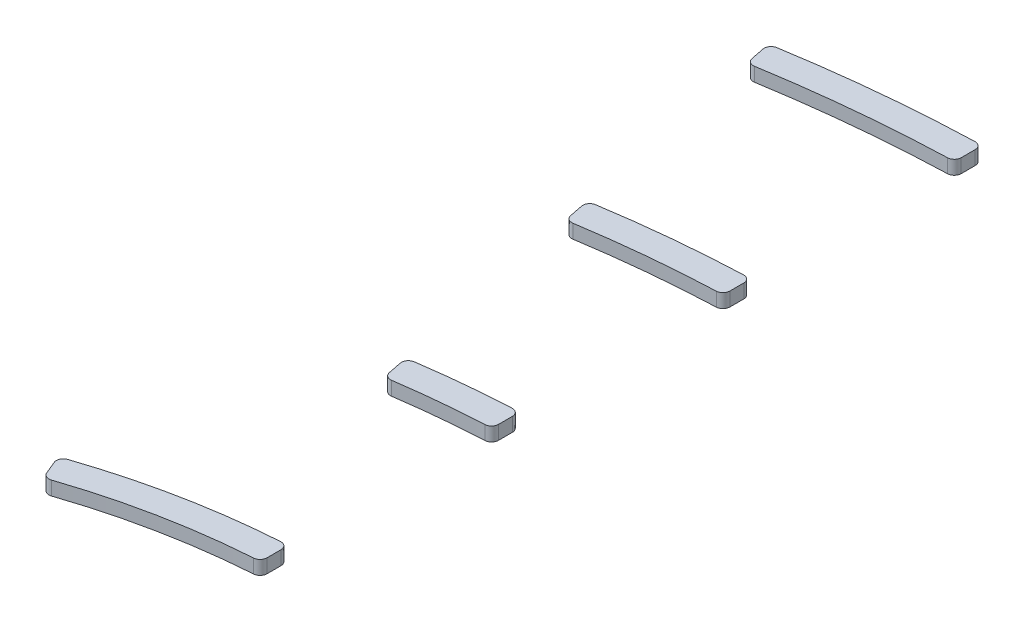
from build123d import *

# Parameters (mm, degrees)
AUFSATZ_LINEAR_AUSTRAGEN1_DEPTH   = 3
AUFSATZ_LINEAR_AUSTRAGEN1_2_DEPTH = 3
AUFSATZ_LINEAR_AUSTRAGEN1_3_DEPTH = 3
AUFSATZ_LINEAR_AUSTRAGEN1_4_DEPTH = 3


with BuildPart() as part:
    # Skizze1 → Aufsatz-Linear austragen1 (new body)
    with BuildSketch(Plane(origin=(0, 0, 0), x_dir=(1, 0, 0), z_dir=(0, 1, 0))):
        with BuildLine():
            Line((-8.459259515, 300.16557037), (-8.461766311, 297.163818853))
            ThreePointArc((-8.461766311, 297.163818853), (-8.883919397, 296.121880665), (-9.911510017, 295.665913636))
            ThreePointArc((-9.911510017, 295.665913636), (-28.996200706, 294.407525145), (-47.95969069, 291.918547863))
            ThreePointArc((-47.95969069, 291.918547863), (-49.056377816, 292.165205658), (-49.673747794, 293.104576208))
            Line((-49.673747794, 293.104576208), (-50.262352563, 296.048073311))
            ThreePointArc((-50.262352563, 296.048073311), (-50.025118954, 297.195499354), (-49.035160138, 297.822275112))
            ThreePointArc((-49.035160138, 297.822275112), (-29.5845698, 300.378607282), (-10.00900024, 301.665998079))
            ThreePointArc((-10.00900024, 301.665998079), (-8.915883192, 301.244490397), (-8.459259515, 300.16557037))
        make_face()
    extrude(amount=AUFSATZ_LINEAR_AUSTRAGEN1_DEPTH)


with BuildPart() as body_2:
    # Skizze1 → Aufsatz-Linear austragen1 2 (new body)
    with BuildSketch(Plane(origin=(0, 0, 0), x_dir=(1, 0, 0), z_dir=(0, 1, 0))):
        with BuildLine():
            Line((-48.346968769, 139.159115699), (-49.50004695, 141.936330487))
            ThreePointArc((-49.50004695, 141.936330487), (-49.480752189, 143.13112709), (-48.594528312, 143.932699575))
            ThreePointArc((-48.594528312, 143.932699575), (-29.63707112, 148.995618071), (-10.185169404, 151.572796085))
            ThreePointArc((-10.185169404, 151.572796085), (-9.059656793, 151.171382867), (-8.584601893, 150.074918526))
            Line((-8.584601893, 150.074918526), (-8.587113136, 147.06784271))
            ThreePointArc((-8.587113136, 147.06784271), (-8.991191611, 146.044909281), (-9.98447239, 145.572611168))
            ThreePointArc((-9.98447239, 145.572611168), (-28.466529188, 143.110906388), (-46.483776816, 138.312448117))
            ThreePointArc((-46.483776816, 138.312448117), (-47.582189261, 138.368682579), (-48.346968769, 139.159115699))
        make_face()
    extrude(amount=AUFSATZ_LINEAR_AUSTRAGEN1_2_DEPTH)


with BuildPart() as body_3:
    # Skizze1 → Aufsatz-Linear austragen1 3 (new body)
    with BuildSketch(Plane(origin=(0, 0, 0), x_dir=(1, 0, 0), z_dir=(0, 1, 0))):
        with BuildLine():
            Line((-30.055632937, 194.998228293), (-30.644675496, 197.943914697))
            ThreePointArc((-30.644675496, 197.943914697), (-30.400116287, 199.101835671), (-29.392191291, 199.722059334))
            ThreePointArc((-29.392191291, 199.722059334), (-19.777857967, 200.902061283), (-10.117988803, 201.619513431))
            ThreePointArc((-10.117988803, 201.619513431), (-9.008616199, 201.207882549), (-8.542808565, 200.120145998))
            Line((-8.542808565, 200.120145998), (-8.545317206, 197.116185466))
            ThreePointArc((-8.545317206, 197.116185466), (-8.958431865, 196.083667659), (-9.968974137, 195.619382121))
            ThreePointArc((-9.968974137, 195.619382121), (-19.18962485, 194.930965741), (-28.367514003, 193.808171283))
            ThreePointArc((-28.367514003, 193.808171283), (-29.449023063, 194.066372937), (-30.055632937, 194.998228293))
        make_face()
    extrude(amount=AUFSATZ_LINEAR_AUSTRAGEN1_3_DEPTH)


with BuildPart() as body_4:
    # Skizze1 → Aufsatz-Linear austragen1 4 (new body)
    with BuildSketch(Plane(origin=(0, 0, 0), x_dir=(1, 0, 0), z_dir=(0, 1, 0))):
        with BuildLine():
            Line((-39.865659916, 244.056250782), (-40.454418425, 247.000516708))
            ThreePointArc((-40.454418425, 247.000516708), (-40.214264333, 248.152149643), (-39.217113967, 248.776347971))
            ThreePointArc((-39.217113967, 248.776347971), (-24.680817217, 250.636211668), (-10.060952395, 251.647433078))
            ThreePointArc((-10.060952395, 251.647433078), (-8.961319795, 251.229834989), (-8.501030266, 250.147377798))
            Line((-8.501030266, 250.147377798), (-8.50353771, 247.144850529))
            ThreePointArc((-8.50353771, 247.144850529), (-8.922075337, 246.106660909), (-9.942872548, 245.647330431))
            ThreePointArc((-9.942872548, 245.647330431), (-24.092502498, 244.665124171), (-38.161941621, 242.8685609))
            ThreePointArc((-38.161941621, 242.8685609), (-39.252590255, 243.119866915), (-39.865659916, 244.056250782))
        make_face()
    extrude(amount=AUFSATZ_LINEAR_AUSTRAGEN1_4_DEPTH)


solid = Compound([part.part, body_2.part, body_3.part, body_4.part])
